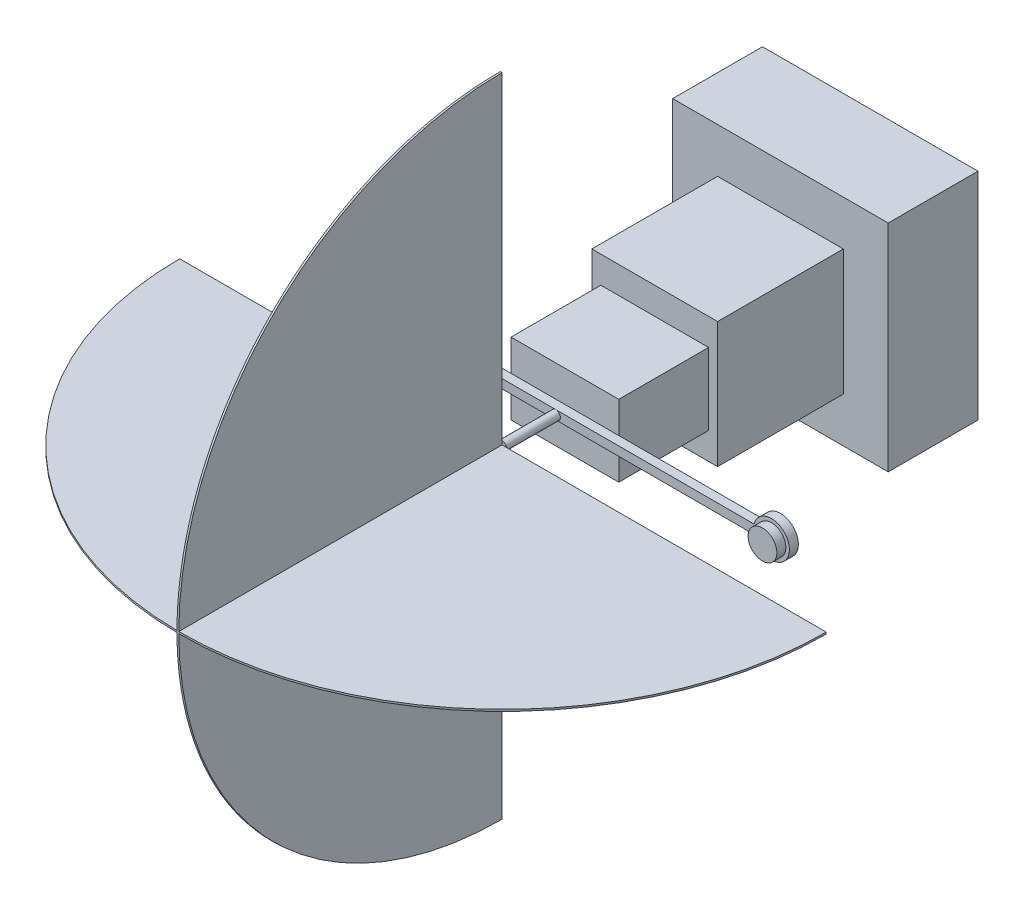
from build123d import *

# Parameters (mm, degrees)
EXTRUDE_2_DEPTH       = 5
SKETCH_3_R            = 8
EXTRUDE_3_DEPTH       = 5
SKETCH_4_W            = 60
SKETCH_4_H            = 40
EXTRUDE_4_DEPTH       = 50
SKETCH_5_W            = 70
SKETCH_5_H            = 70
EXTRUDE_5_DEPTH       = 30
SKETCH_6_R            = 2.5
EXTRUDE_6_DEPTH       = 30
EXTRUDE_11_DEPTH      = 0.5
EXTRUDE_11_DEPTH_BACK = 0.5
EXTRUDE_12_DEPTH      = 0.5
EXTRUDE_12_DEPTH_BACK = 0.5
SKETCH_12_W           = 70
SKETCH_12_H           = 70
EXTRUDE_13_DEPTH      = 40
SKETCH_13_W           = 120
SKETCH_13_H           = 120
EXTRUDE_14_DEPTH      = 50


with BuildPart() as part:
    # 草图1 → 凸台-拉伸2 (new body)
    with BuildSketch(Plane.XY):
        with BuildLine():
            ThreePointArc((-110.317541634, 2.5), (-130, 0), (-110.317541634, -2.5))
            Line((-110.317541634, -2.5), (110.317541634, -2.5))
            ThreePointArc((110.317541634, -2.5), (130, 0), (110.317541634, 2.5))
            Line((110.317541634, 2.5), (-110.317541634, 2.5))
        make_face()
    extrude(amount=EXTRUDE_2_DEPTH)

    # 草图3 → 凸台-拉伸3 (add)
    with BuildSketch(Plane.XY.offset(5)):
        with Locations((-120, 0)):
            Circle(SKETCH_3_R)
        with Locations((120, 0)):
            Circle(SKETCH_3_R)
    extrude(amount=EXTRUDE_3_DEPTH)

    # 草图4 → 凸台-拉伸4 (add)
    with BuildSketch(Plane(origin=(0, 0, 0), x_dir=(-1, 0, 0), z_dir=(0, 0, -1))):
        Rectangle(SKETCH_4_W, SKETCH_4_H)
    extrude(amount=EXTRUDE_4_DEPTH)

    # 草图5 → 凸台-拉伸5 (add)
    with BuildSketch(Plane(origin=(0, 0, -50), x_dir=(-1, 0, 0), z_dir=(0, 0, -1))):
        Rectangle(SKETCH_5_W, SKETCH_5_H)
    extrude(amount=EXTRUDE_5_DEPTH)

    # 草图6 → 凸台-拉伸6 (add)
    with BuildSketch(Plane.XY.offset(5)):
        with Locations(Location((0, 0, 0), (0, 0, 270))):
            Circle(SKETCH_6_R)
    extrude(amount=EXTRUDE_6_DEPTH)

    # 草图10 → 凸台-拉伸11 (add, two sides: drawn at the far end of the back side and taken through both)
    with BuildSketch(Plane(origin=(0, 0, 0), x_dir=(-1, 0, 0), z_dir=(0, -1, 0)).offset(-EXTRUDE_11_DEPTH_BACK)):
        with BuildLine():
            Line((179.5, -35), (-180.5, -35))
            ThreePointArc((-180.5, -35), (-0.5, -215), (179.5, -35))
        make_face()
    extrude(amount=EXTRUDE_11_DEPTH + EXTRUDE_11_DEPTH_BACK)

    # 草图11 → 凸台-拉伸12 (add, two sides: drawn at the far end of the back side and taken through both)
    with BuildSketch(Plane.ZY.offset(0.5).offset(-EXTRUDE_12_DEPTH_BACK)):
        with BuildLine():
            Line((35, 180), (35, -180))
            ThreePointArc((35, -180), (215, 0), (35, 180))
        make_face()
    extrude(amount=EXTRUDE_12_DEPTH + EXTRUDE_12_DEPTH_BACK)

    # 草图12 → 凸台-拉伸13 (add)
    with BuildSketch(Plane(origin=(0, 0, -80), x_dir=(-1, 0, 0), z_dir=(0, 0, -1))):
        Rectangle(SKETCH_12_W, SKETCH_12_H)
    extrude(amount=EXTRUDE_13_DEPTH)

    # 草图13 → 凸台-拉伸14 (add)
    with BuildSketch(Plane(origin=(0, 0, -120), x_dir=(-1, 0, 0), z_dir=(0, 0, -1))):
        Rectangle(SKETCH_13_W, SKETCH_13_H)
    extrude(amount=EXTRUDE_14_DEPTH)


solid = part.part
